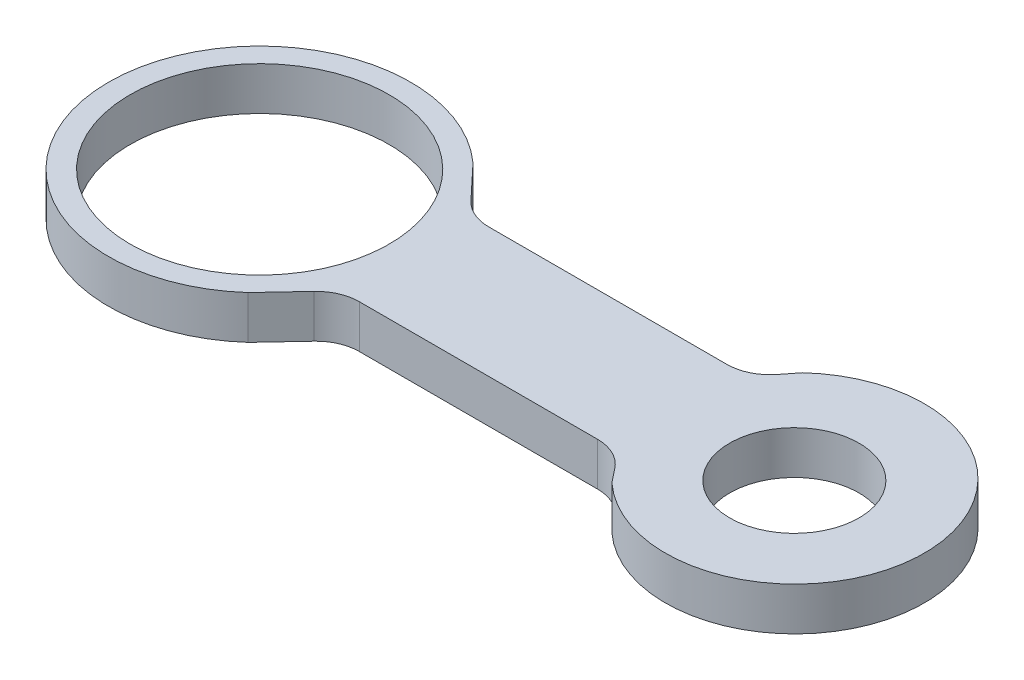
from build123d import *

# Parameters (mm, degrees)
SKETCH1_R           = 0.605786837
BOSS_EXTRUDE1_DEPTH = 10
SKETCH3_R           = 30
SKETCH3_R_2         = 15
CUT_EXTRUDE1_DEPTH  = 10


with BuildPart() as part:
    # Sketch1 → Boss-Extrude1 (new body)
    with BuildSketch(Plane(origin=(0, 0, 0), x_dir=(1, 0, 0), z_dir=(0, 1, 0))):
        with BuildLine():
            Line((42.395388783, 14.504200511), (45.014187909, 17.812893064))
            ThreePointArc((45.014187909, 17.812893064), (95.299132477, -4.289618646), (45.014187909, -26.392130356))
            Line((45.014187909, -26.392130356), (42.395388783, -23.083437803))
            ThreePointArc((42.395388783, -23.083437803), (38.909611349, -20.287901909), (34.554258804, -19.289618646))
            Line((34.554258804, -19.289618646), (-20.607383501, -19.289618646))
            ThreePointArc((-20.607383501, -19.289618646), (-24.579180908, -20.112210224), (-27.897544897, -22.444653576))
            Line((-27.897544897, -22.444653576), (-35.310368622, -30.339607137))
            ThreePointArc((-35.310368622, -30.339607137), (-93.685528507, -4.289618646), (-35.310368622, 21.760369845))
            Line((-35.310368622, 21.760369845), (-27.897544897, 13.865416283))
            ThreePointArc((-27.897544897, 13.865416283), (-24.579180908, 11.532972931), (-20.607383501, 10.710381354))
            Line((-20.607383501, 10.710381354), (34.554258804, 10.710381354))
            ThreePointArc((34.554258804, 10.710381354), (38.909611349, 11.708664617), (42.395388783, 14.504200511))
        make_face()
        with Locations(Location((65.299132477, -4.289618646, 0), (0, 0, 270))):
            Circle(SKETCH1_R, mode=Mode.SUBTRACT)
    extrude(amount=BOSS_EXTRUDE1_DEPTH)

    # Sketch3 → Cut-Extrude1 (cut)
    with BuildSketch(Plane(origin=(0, 10, 0), x_dir=(1, 0, 0), z_dir=(0, 1, 0))):
        with Locations(Location((-58.685528507, -4.289618646, 0), (0, 0, 270))):
            Circle(SKETCH3_R)
        with Locations(Location((65.664200703, -4.773046906, 0), (0, 0, 270))):
            Circle(SKETCH3_R_2)
    extrude(amount=-CUT_EXTRUDE1_DEPTH, mode=Mode.SUBTRACT)


solid = part.part
